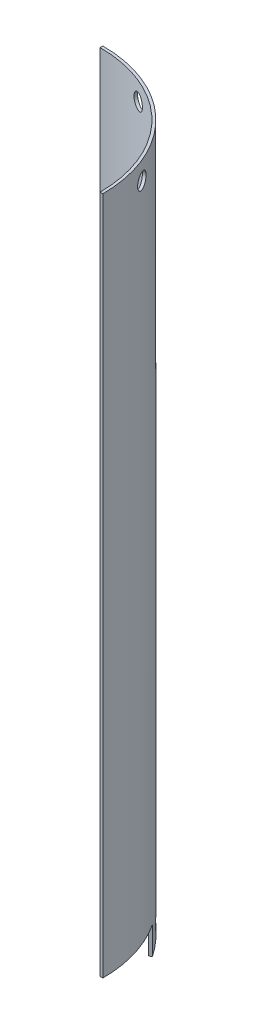
from build123d import *

# Parameters (mm, degrees)
BOSS_EXTRUDE1_DEPTH     = 508.5
CUT_EXTRUDE4_REACH      = 518.756
CUT_EXTRUDE4_END_RADIUS = 90
SKETCH6_R               = 5.565
CUT_EXTRUDE2_REACH      = 520.673
CUT_EXTRUDE2_END_RADIUS = 90
SKETCH3_R               = 5.565
CUT_EXTRUDE3_REACH      = 520.673
CUT_EXTRUDE3_END_RADIUS = 90
SKETCH5_R               = 5.565
LPATTERN2_COUNT         = 2
LPATTERN2_PITCH         = 485.5
CUT_EXTRUDE5_DEPTH      = 20


with BuildPart() as part:
    # Sketch1 → Boss-Extrude1 (new body)
    with BuildSketch(Plane(origin=(0, 0, 0), x_dir=(1, 0, 0), z_dir=(0, 1, 0))):
        with BuildLine():
            Line((0, 92), (0, 90))
            ThreePointArc((0, 90), (63.639610307, 63.639610307), (90, 0))
            Line((90, 0), (92, 0))
            ThreePointArc((92, 0), (65.053823869, 65.053823869), (0, 92))
        make_face()
    extrude(amount=BOSS_EXTRUDE1_DEPTH)

    # Cut-Extrude4: up to this cylinder (the profile starts outside it)
    cut_extrude4_end = Plane(origin=(0, 10, 0), z_dir=(0, -1, 0)) * Cylinder(CUT_EXTRUDE4_END_RADIUS, 1218.512, mode=Mode.PRIVATE)
    # Sketch6 → Cut-Extrude4 (cut, up to the surface)
    with BuildSketch(Plane(origin=(65.053823869, 0, -65.053823869), x_dir=(-0.7071067811865486, 0, -0.7071067811865465), z_dir=(0.7071067811865465, 0, -0.7071067811865486)), mode=Mode.PRIVATE) as cut_extrude4_sk1:
        with Locations((0, 10)):
            Circle(SKETCH6_R)
    cut_extrude4_tool1 = extrude(cut_extrude4_sk1.sketch, amount=-CUT_EXTRUDE4_REACH, mode=Mode.PRIVATE) - cut_extrude4_end
    add(cut_extrude4_tool1.solids().sort_by_distance((65.053824, 10, -65.053824))[0], mode=Mode.SUBTRACT)

    # Cut-Extrude2: up to this cylinder (the profile starts outside it)
    cut_extrude2_end = Plane(origin=(0, 10, 0), z_dir=(0, -1, 0)) * Cylinder(CUT_EXTRUDE2_END_RADIUS, 1222.346, mode=Mode.PRIVATE)
    # Sketch3 → Cut-Extrude2 (cut, up to the surface)
    with BuildSketch(Plane(origin=(84.996916991, 0, -35.206875778), x_dir=(-0.38268343236509045, 0, -0.9238795325112865), z_dir=(0.9238795325112865, 0, -0.38268343236509045)), mode=Mode.PRIVATE) as cut_extrude2_sk1:
        with Locations((0, 10)):
            Circle(SKETCH3_R)
    cut_extrude2_tool1 = extrude(cut_extrude2_sk1.sketch, amount=-CUT_EXTRUDE2_REACH, mode=Mode.PRIVATE) - cut_extrude2_end
    cut_extrude2 = cut_extrude2_tool1.solids().sort_by_distance((84.996917, 10, -35.206876))[0]
    add(cut_extrude2, mode=Mode.SUBTRACT)

    # Cut-Extrude3: up to this cylinder (the profile starts outside it)
    cut_extrude3_end = Plane(origin=(0, 10, 0), z_dir=(0, -1, 0)) * Cylinder(CUT_EXTRUDE3_END_RADIUS, 1222.346, mode=Mode.PRIVATE)
    # Sketch5 → Cut-Extrude3 (cut, up to the surface)
    with BuildSketch(Plane(origin=(35.206875778, 0, -84.996916991), x_dir=(-0.9238795325112878, 0, -0.3826834323650876), z_dir=(0.3826834323650876, 0, -0.9238795325112878)), mode=Mode.PRIVATE) as cut_extrude3_sk1:
        with Locations((0, 10)):
            Circle(SKETCH5_R)
    cut_extrude3_tool1 = extrude(cut_extrude3_sk1.sketch, amount=-CUT_EXTRUDE3_REACH, mode=Mode.PRIVATE) - cut_extrude3_end
    cut_extrude3 = cut_extrude3_tool1.solids().sort_by_distance((35.206876, 10, -84.996917))[0]
    add(cut_extrude3, mode=Mode.SUBTRACT)

    # LPattern2: Cut-Extrude2, Cut-Extrude3 ×2
    with Locations(*[(0, i * LPATTERN2_PITCH, 0) for i in range(1, LPATTERN2_COUNT)]):
        add(cut_extrude2, mode=Mode.SUBTRACT)
        add(cut_extrude3, mode=Mode.SUBTRACT)

    # Sketch7 → Cut-Extrude5 (cut)
    with BuildSketch(Plane.XZ):
        with BuildLine():
            ThreePointArc((90, 0), (86.112133982, -26.166780106), (74.784435976, -50.072828318))
            Line((74.784435976, -50.072828318), (76.447375943, -51.183969281))
            ThreePointArc((76.447375943, -51.183969281), (88.026014867, -26.747349525), (92, 0))
            Line((92, 0), (90, 0))
        make_face()
        with BuildLine():
            Line((51.183969281, -76.447375943), (50.072828318, -74.784435976))
            ThreePointArc((50.072828318, -74.784435976), (26.166780106, -86.112133982), (0, -90))
            Line((0, -90), (0, -92))
            ThreePointArc((0, -92), (26.747349525, -88.026014867), (51.183969281, -76.447375943))
        make_face()
    extrude(amount=-CUT_EXTRUDE5_DEPTH, mode=Mode.SUBTRACT)


solid = part.part
